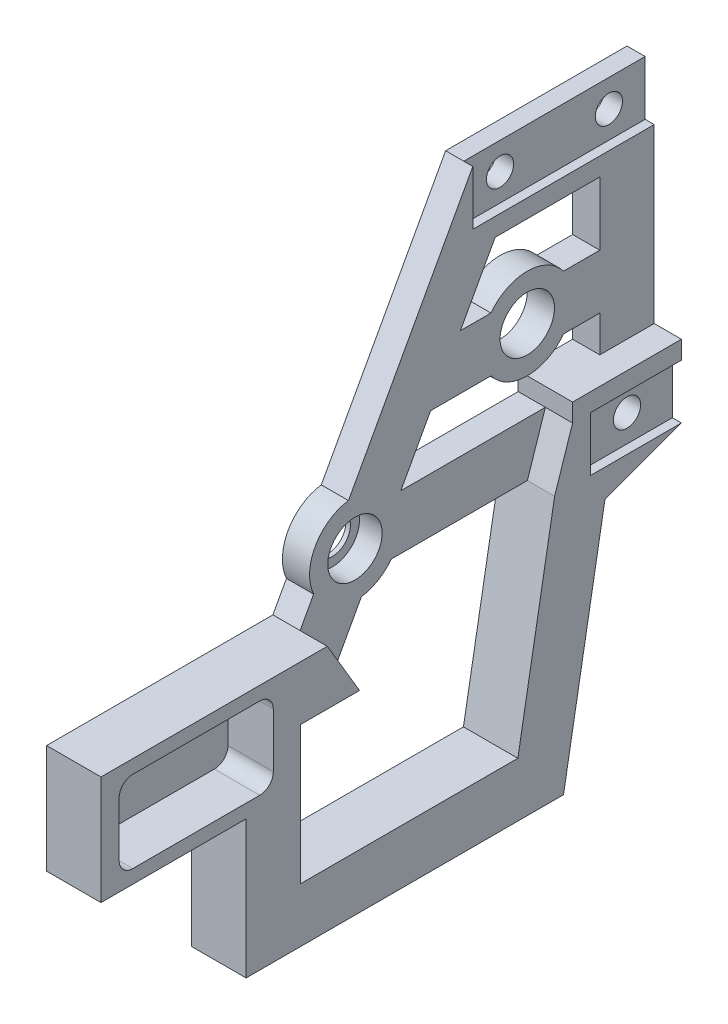
from build123d import *

# Parameters (mm, degrees)
SKETCH1_R                   = 1.5
SKETCH1_R_2                 = 3
SKETCH1_R_3                 = 2
BOSS_EXTRUDE1_DEPTH         = 6
TAP_DRILL_FOR_M3_TAP1_D     = 2.5
TAP_DRILL_FOR_M3_TAP1_DEPTH = 9
TAP_DRILL_FOR_M3_TAP1_TIP   = 0.751075774
CUT_EXTRUDE4_DEPTH          = 3
SKETCH14_W                  = 20
SKETCH14_H                  = 6
CUT_EXTRUDE5_DEPTH          = 1
SKETCH15_W                  = 10
SKETCH15_H                  = 6
CUT_EXTRUDE6_DEPTH          = 1
SKETCH16_R                  = 3
CUT_EXTRUDE7_DEPTH          = 2.5
SKETCH17_W                  = 17
SKETCH17_H                  = 9
CUT_EXTRUDE8_DEPTH          = 5
FILLET1_R                   = 1.5


with BuildPart() as part:
    # Sketch1 → Boss-Extrude1 (new body)
    with BuildSketch(Plane(origin=(0, 0, 0), x_dir=(0, 0, -1), z_dir=(1, 0, 0))):
        with BuildLine():
            Line((51, 0), (55.572632785, 25.93268918))
            Line((55.572632785, 25.93268918), (64, 29))
            Line((64, 29), (64, 62))
            Line((64, 62), (44, 62))
            Line((44, 62), (30.288877114, 36.949172076))
            ThreePointArc((30.288877114, 36.949172076), (26.613988607, 34.400604937), (26.447909215, 29.931553848))
            Line((26.447909215, 29.931553848), (24.952842042, 27.2))
            Line((24.952842042, 27.2), (0, 27.2))
            Line((0, 27.2), (0, 15.2))
            Line((0, 15.2), (16, 15.2))
            Line((16, 15.2), (16, 0))
            Line((16, 0), (51, 0))
        make_face()
        with Locations((59, 32)):
            Circle(SKETCH1_R, mode=Mode.SUBTRACT)
        with Locations((50, 44)):
            Circle(SKETCH1_R_2, mode=Mode.SUBTRACT)
        with Locations((60, 59)):
            Circle(SKETCH1_R, mode=Mode.SUBTRACT)
        with Locations((48, 59)):
            Circle(SKETCH1_R, mode=Mode.SUBTRACT)
        with Locations((31, 32)):
            Circle(SKETCH1_R_3, mode=Mode.SUBTRACT)
        with BuildLine():
            Line((39.345952884, 41), (36.061960132, 35))
            Line((36.061960132, 35), (52, 35))
            Line((52, 35), (52, 37))
            Line((52, 37), (58, 37))
            Line((58, 37), (58, 41))
            Line((58, 41), (54, 41))
            ThreePointArc((54, 41), (50, 39), (46, 41))
            Line((46, 41), (39.345952884, 41))
        make_face(mode=Mode.SUBTRACT)
        with BuildLine():
            Line((46.461270512, 54), (42.629945635, 47))
            Line((42.629945635, 47), (46, 47))
            ThreePointArc((46, 47), (50, 49), (54, 47))
            Line((54, 47), (58, 47))
            Line((58, 47), (58, 54))
            Line((58, 54), (46.461270512, 54))
        make_face(mode=Mode.SUBTRACT)
        with BuildLine():
            Line((35, 29), (50.020922769, 29))
            Line((50.020922769, 29), (45.965402213, 6))
            Line((45.965402213, 6), (22, 6))
            Line((22, 6), (22, 21.2))
            Line((22, 21.2), (28.508776804, 21.2))
            Line((28.508776804, 21.2), (31.711122886, 27.050827924))
            ThreePointArc((31.711122886, 27.050827924), (33.549213145, 27.698661564), (35, 29))
        make_face(mode=Mode.SUBTRACT)
    extrude(amount=BOSS_EXTRUDE1_DEPTH)

    # Tap Drill for M3 Tap1
    with Locations(Plane(origin=(0, 0, 0), x_dir=(-1, 0, 0), z_dir=(0, -1, 0))):
        with Locations((-3, 48), (-3, 19)):
            Hole(TAP_DRILL_FOR_M3_TAP1_D / 2, depth=TAP_DRILL_FOR_M3_TAP1_DEPTH)
            with Locations((0, 0, -(TAP_DRILL_FOR_M3_TAP1_DEPTH + TAP_DRILL_FOR_M3_TAP1_TIP / 2))):  # 118° drill point
                Cone(0, TAP_DRILL_FOR_M3_TAP1_D / 2, TAP_DRILL_FOR_M3_TAP1_TIP, mode=Mode.SUBTRACT)

    # Sketch13 → Cut-Extrude4 (cut)
    with BuildSketch(Plane(origin=(6, 0, 0), x_dir=(0, 0, -1), z_dir=(1, 0, 0))):
        Polygon((52, 37), (64, 37), (64, 62), (44, 62), (30.288877114, 36.949172076), (28.008901276, 36.949172076), (23.767530455, 29.2), (28.508776804, 21.2), (50.020922769, 29), (52, 35), align=None)
    extrude(amount=-CUT_EXTRUDE4_DEPTH, mode=Mode.SUBTRACT)

    # Sketch14 → Cut-Extrude5 (cut)
    with BuildSketch(Plane(origin=(3, 0, 0), x_dir=(0, 0, -1), z_dir=(1, 0, 0))):
        with Locations((54, 59)):
            Rectangle(SKETCH14_W, SKETCH14_H)
    extrude(amount=-CUT_EXTRUDE5_DEPTH, mode=Mode.SUBTRACT)

    # Sketch15 → Cut-Extrude6 (cut)
    with BuildSketch(Plane(origin=(6, 0, 0), x_dir=(0, 0, -1), z_dir=(1, 0, 0))):
        with Locations((59, 32)):
            Rectangle(SKETCH15_W, SKETCH15_H)
    extrude(amount=-CUT_EXTRUDE6_DEPTH, mode=Mode.SUBTRACT)

    # Sketch16 → Cut-Extrude7 (cut)
    with BuildSketch(Plane(origin=(3, 0, 0), x_dir=(0, 0, -1), z_dir=(1, 0, 0))):
        with Locations((31, 32)):
            Circle(SKETCH16_R)
    extrude(amount=-CUT_EXTRUDE7_DEPTH, mode=Mode.SUBTRACT)

    # Sketch17 → Cut-Extrude8 (cut)
    with BuildSketch(Plane(origin=(6, 0, 0), x_dir=(0, 0, -1), z_dir=(1, 0, 0))):
        with Locations((10.5, 21.2)):
            Rectangle(SKETCH17_W, SKETCH17_H)
    extrude(amount=-CUT_EXTRUDE8_DEPTH, mode=Mode.SUBTRACT)

    # Fillet1
    fillet1_edges = [part.edges().sort_by_distance(p)[0] for p in [
        (3.5, 16.7, -2),
        (3.5, 25.7, -2),
        (3.5, 25.7, -19),
        (3.5, 16.7, -19),
    ]]
    fillet(fillet1_edges, radius=FILLET1_R)


solid = part.part
